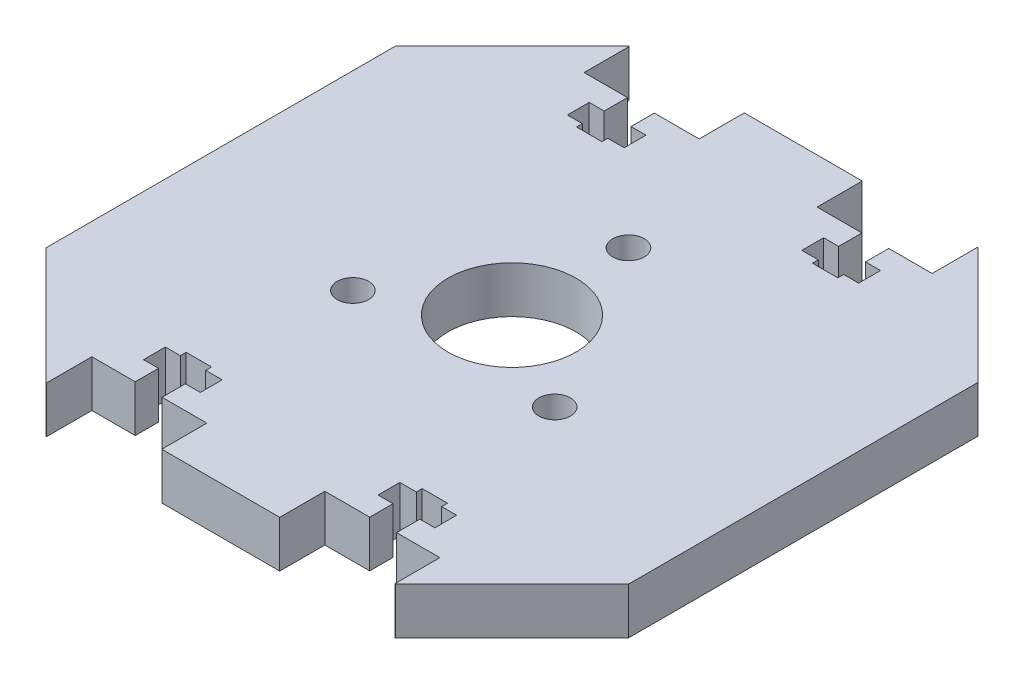
from build123d import *

# Parameters (mm, degrees)
SKETCH1_R           = 2.15265
SKETCH1_R_2         = 8.73125
BOSS_EXTRUDE1_DEPTH = 6.35
CUT_EXTRUDE1_DEPTH  = 57.484668827


with BuildPart() as part:
    # Sketch1 → Boss-Extrude1 (new body)
    with BuildSketch(Plane(origin=(0, 0, 0), x_dir=(1, 0, 0), z_dir=(0, 1, 0))):
        Polygon((23.8125, 39.6875), (-23.8125, 39.6875), (-39.6875, 23.8125), (-39.6875, -23.8125), (-23.8125, -39.6875), (23.8125, -39.6875), (39.6875, -23.8125), (39.6875, 23.8125), align=None)
        with Locations(Location((-13.748153285, -7.9375, 0), (0, 0, 270))):
            Circle(SKETCH1_R, mode=Mode.SUBTRACT)
        with Locations(Location((13.748153285, -7.9375, 0), (0, 0, 270))):
            Circle(SKETCH1_R, mode=Mode.SUBTRACT)
        with Locations(Location((0, 0, 0), (0, 0, 270))):
            Circle(SKETCH1_R_2, mode=Mode.SUBTRACT)
        with Locations(Location((0, 15.875, 0), (0, 0, 270))):
            Circle(SKETCH1_R, mode=Mode.SUBTRACT)
    extrude(amount=BOSS_EXTRUDE1_DEPTH)

    # Sketch2 → Cut-Extrude1 (cut, through all)
    with BuildSketch(Plane(origin=(0, 6.35, 0), x_dir=(1, 0, 0), z_dir=(0, 1, 0))):
        Polygon((-8.0375, 39.6875), (-23.7125, 39.6875), (-23.7125, 33.5375), (-17.8038, 33.5375), (-17.8038, 30.3625), (-19.84375, 30.3625), (-19.84375, 27.3875), (-17.8038, 27.3875), (-17.8038, 26.59375), (-14.3462, 26.59375), (-14.3462, 27.3875), (-12.10625, 27.3875), (-12.10625, 30.3625), (-14.1462, 30.3625), (-14.1462, 33.5375), (-8.0375, 33.5375), align=None)
        Polygon((23.7125, 39.6875), (8.0375, 39.6875), (8.0375, 33.5375), (14.1462, 33.5375), (14.1462, 30.3625), (12.10625, 30.3625), (12.10625, 27.3875), (14.3462, 27.3875), (14.3462, 26.59375), (17.8038, 26.59375), (17.8038, 27.3875), (19.84375, 27.3875), (19.84375, 30.3625), (17.8038, 30.3625), (17.8038, 33.5375), (23.7125, 33.5375), align=None)
        Polygon((-23.7125, -33.5375), (-23.7125, -39.6875), (-8.0375, -39.6875), (-8.0375, -33.5375), (-14.1462, -33.5375), (-14.1462, -30.3625), (-12.10625, -30.3625), (-12.10625, -27.3875), (-14.3462, -27.3875), (-14.3462, -26.59375), (-17.8038, -26.59375), (-17.8038, -27.3875), (-19.84375, -27.3875), (-19.84375, -30.3625), (-17.8038, -30.3625), (-17.8038, -33.5375), align=None)
        Polygon((8.0375, -33.5375), (8.0375, -39.6875), (23.7125, -39.6875), (23.7125, -33.5375), (17.8038, -33.5375), (17.8038, -30.3625), (19.84375, -30.3625), (19.84375, -27.3875), (17.8038, -27.3875), (17.8038, -26.59375), (14.3462, -26.59375), (14.3462, -27.3875), (12.10625, -27.3875), (12.10625, -30.3625), (14.1462, -30.3625), (14.1462, -33.5375), align=None)
    extrude(amount=-CUT_EXTRUDE1_DEPTH, mode=Mode.SUBTRACT)


solid = part.part
